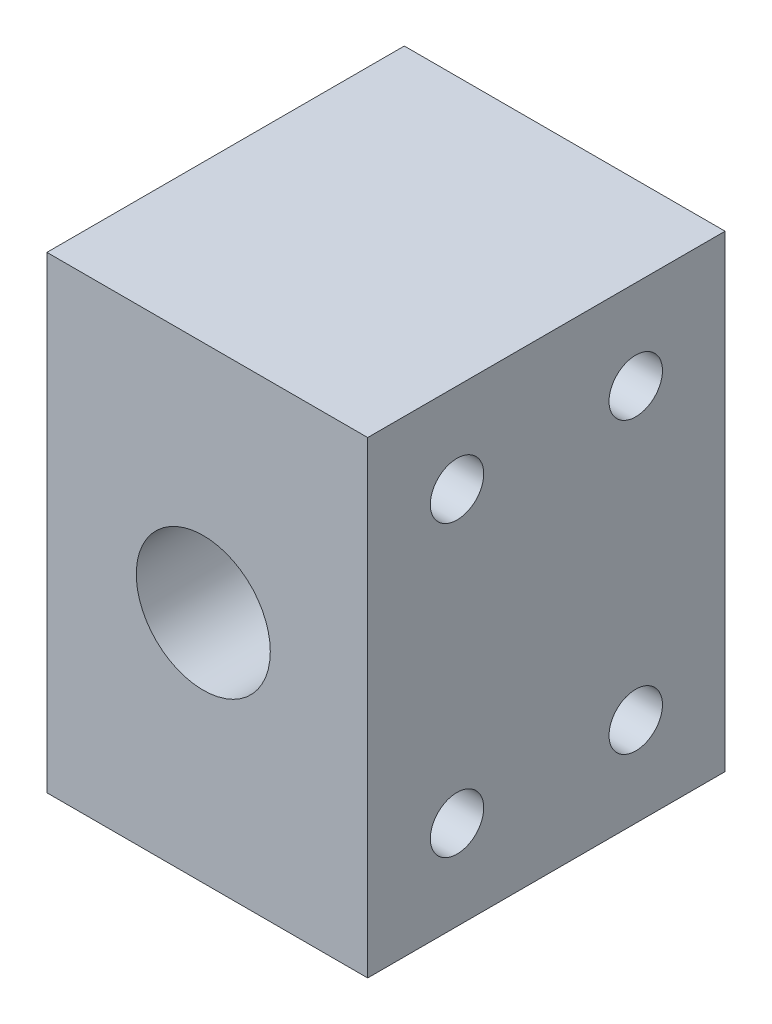
from build123d import *

# Parameters (mm, degrees)
SKETCH1_W                            = 22.7965
SKETCH1_H                            = 33.263796714
SKETCH1_R                            = 4.7625
BOSS_EXTRUDE1_DEPTH                  = 25.4
SET_SCREW_10_24_TAPPED_HOLE1_REACH   = 49.658
SET_SCREW_10_24_TAPPED_HOLE1_BORE_R  = 1.89865
MOUNT_SCREW_10_24_TAPPED_HOLE2_D     = 3.7973
MOUNT_SCREW_10_24_TAPPED_HOLE2_DEPTH = 12.954
MOUNT_SCREW_10_24_TAPPED_HOLE2_TIP   = 1.140824014


with BuildPart() as part:
    # Sketch1 → Boss-Extrude1 (new body)
    with BuildSketch(Plane.XY):
        with Locations((11.39825, 16.631898357)):
            Rectangle(SKETCH1_W, SKETCH1_H)
        with Locations((11.1125, 16.631898357)):
            Circle(SKETCH1_R, mode=Mode.SUBTRACT)
    extrude(amount=BOSS_EXTRUDE1_DEPTH)

    # set screw #10-24 Tapped Hole1 bore → set screw #10-24 Tapped Hole1 (cut, up to next)
    with BuildSketch(Plane.ZY, mode=Mode.PRIVATE) as set_screw_10_24_tapped_hole1_sk1:
        with Locations((12.7, 16.631898357)):
            Circle(SET_SCREW_10_24_TAPPED_HOLE1_BORE_R)
    set_screw_10_24_tapped_hole1_tool1 = extrude(set_screw_10_24_tapped_hole1_sk1.sketch, amount=-SET_SCREW_10_24_TAPPED_HOLE1_REACH, mode=Mode.PRIVATE) & part.part
    add(set_screw_10_24_tapped_hole1_tool1.solids().sort_by_distance((0, 16.631898, 12.7))[0], mode=Mode.SUBTRACT)

    # mount screw #10-24 Tapped Hole2
    with Locations(Plane(origin=(22.7965, 0, 0), x_dir=(0, 0, -1), z_dir=(1, 0, 0))):
        with Locations((-19.05, 26.913796714), (-6.35, 26.913796714), (-19.05, 6.35), (-6.35, 6.35)):
            Hole(MOUNT_SCREW_10_24_TAPPED_HOLE2_D / 2, depth=MOUNT_SCREW_10_24_TAPPED_HOLE2_DEPTH)
            with Locations((0, 0, -(MOUNT_SCREW_10_24_TAPPED_HOLE2_DEPTH + MOUNT_SCREW_10_24_TAPPED_HOLE2_TIP / 2))):  # 118° drill point
                Cone(0, MOUNT_SCREW_10_24_TAPPED_HOLE2_D / 2, MOUNT_SCREW_10_24_TAPPED_HOLE2_TIP, mode=Mode.SUBTRACT)


solid = part.part
